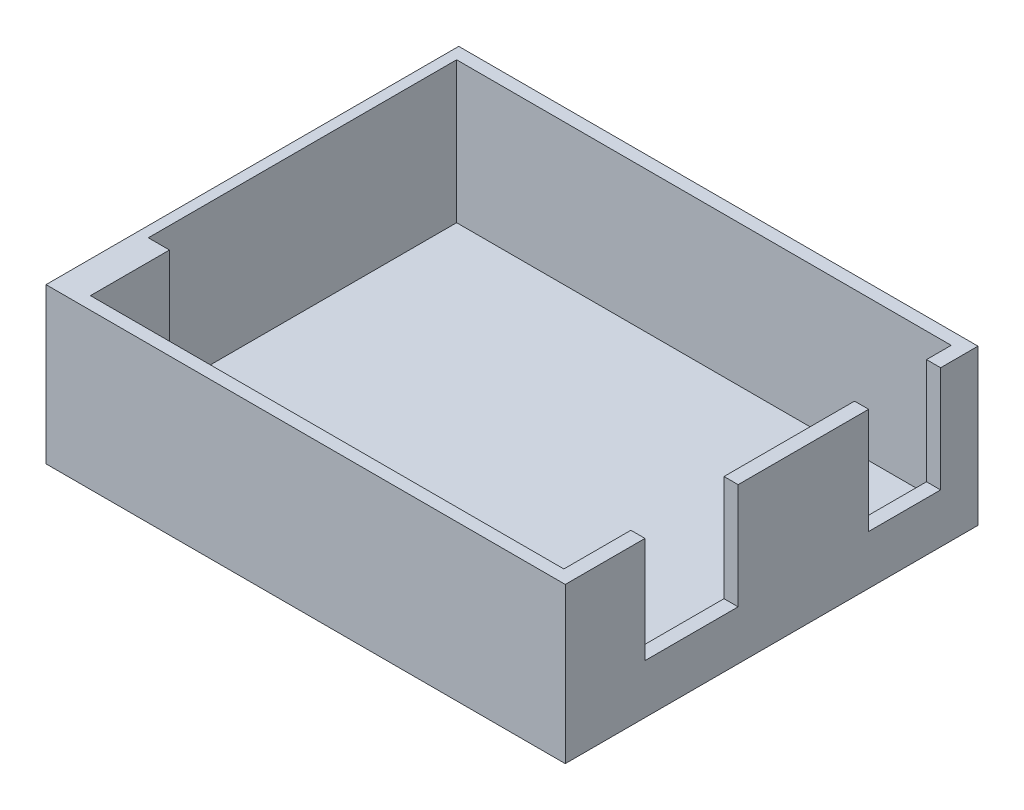
from build123d import *

# Parameters (mm, degrees)
SKETCH_1_W          = 73.6
SKETCH_1_H          = 58.5
EXTRUDE_1_DEPTH     = 22
CUT_EXTRUDE_2_DEPTH = 20
SKETCH_4_W          = 2
SKETCH_4_H          = 10.2
SKETCH_4_H_2        = 13.2
EXTRUDE_2_DEPTH     = 5


with BuildPart() as part:
    # Эскиз1 → Бобышка-Вытянуть1 (new body)
    with BuildSketch(Plane(origin=(0, 0, 0), x_dir=(1, 0, 0), z_dir=(0, 1, 0))):
        with Locations((36.8, -29.25)):
            Rectangle(SKETCH_1_W, SKETCH_1_H)
    extrude(amount=EXTRUDE_1_DEPTH)

    # Эскиз3 → Вырез-Вытянуть2 (cut)
    with BuildSketch(Plane(origin=(0, 22, 0), x_dir=(1, 0, 0), z_dir=(0, 1, 0))):
        Polygon((1.5, -1.8), (71.6, -1.8), (71.6, -5.3), (73.6, -5.3), (73.6, -15.5), (71.6, -15.5), (71.6, -34), (73.6, -34), (73.6, -47.2), (71.6, -47.2), (71.6, -56.7), (4.5, -56.7), (4.5, -45.5), (1.5, -45.5), align=None)
    extrude(amount=-CUT_EXTRUDE_2_DEPTH, mode=Mode.SUBTRACT)

    # Эскиз4 → Бобышка-Вытянуть2 (add)
    with BuildSketch(Plane(origin=(0, 2, 0), x_dir=(1, 0, 0), z_dir=(0, 1, 0))):
        with Locations((72.6, -10.4)):
            Rectangle(SKETCH_4_W, SKETCH_4_H)
        with Locations((72.6, -40.6)):
            Rectangle(SKETCH_4_W, SKETCH_4_H_2)
    extrude(amount=EXTRUDE_2_DEPTH)


solid = part.part
